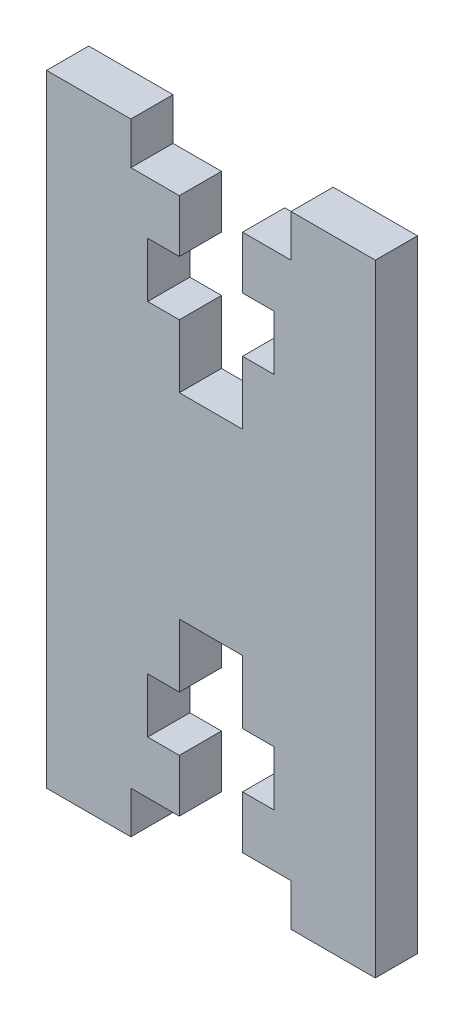
from build123d import *

# Parameters (mm, degrees)
EXTRUDE_1_DEPTH = 2


with BuildPart() as part:
    # 草图2 → 凸台-拉伸1 (new body)
    with BuildSketch(Plane.XY):
        Polygon((0.753104923, 6.357612039), (3.053104923, 6.357612039), (3.053104923, 8.357612039), (7.053104923, 8.357612039), (7.053104923, -21.142387961), (3.053104923, -21.142387961), (3.053104923, -19.142387961), (0.753104923, -19.142387961), (0.753104923, -16.642387961), (2.253104923, -16.642387961), (2.253104923, -14.042387961), (0.753104923, -14.042387961), (0.753104923, -11.042387961), (-2.246895077, -11.042387961), (-2.246895077, -14.042387961), (-3.746895077, -14.042387961), (-3.746895077, -16.642387961), (-2.246895077, -16.642387961), (-2.246895077, -19.142387961), (-4.546895077, -19.142387961), (-4.546895077, -21.142387961), (-8.546895077, -21.142387961), (-8.546895077, 8.357612039), (-4.546895077, 8.357612039), (-4.546895077, 6.357612039), (-2.246895077, 6.357612039), (-2.246895077, 3.857612039), (-3.746895077, 3.857612039), (-3.746895077, 1.257612039), (-2.246895077, 1.257612039), (-2.246895077, -1.742387961), (0.753104923, -1.742387961), (0.753104923, 1.257612039), (2.253104923, 1.257612039), (2.253104923, 3.857612039), (0.753104923, 3.857612039), align=None)
    extrude(amount=EXTRUDE_1_DEPTH)


solid = part.part
